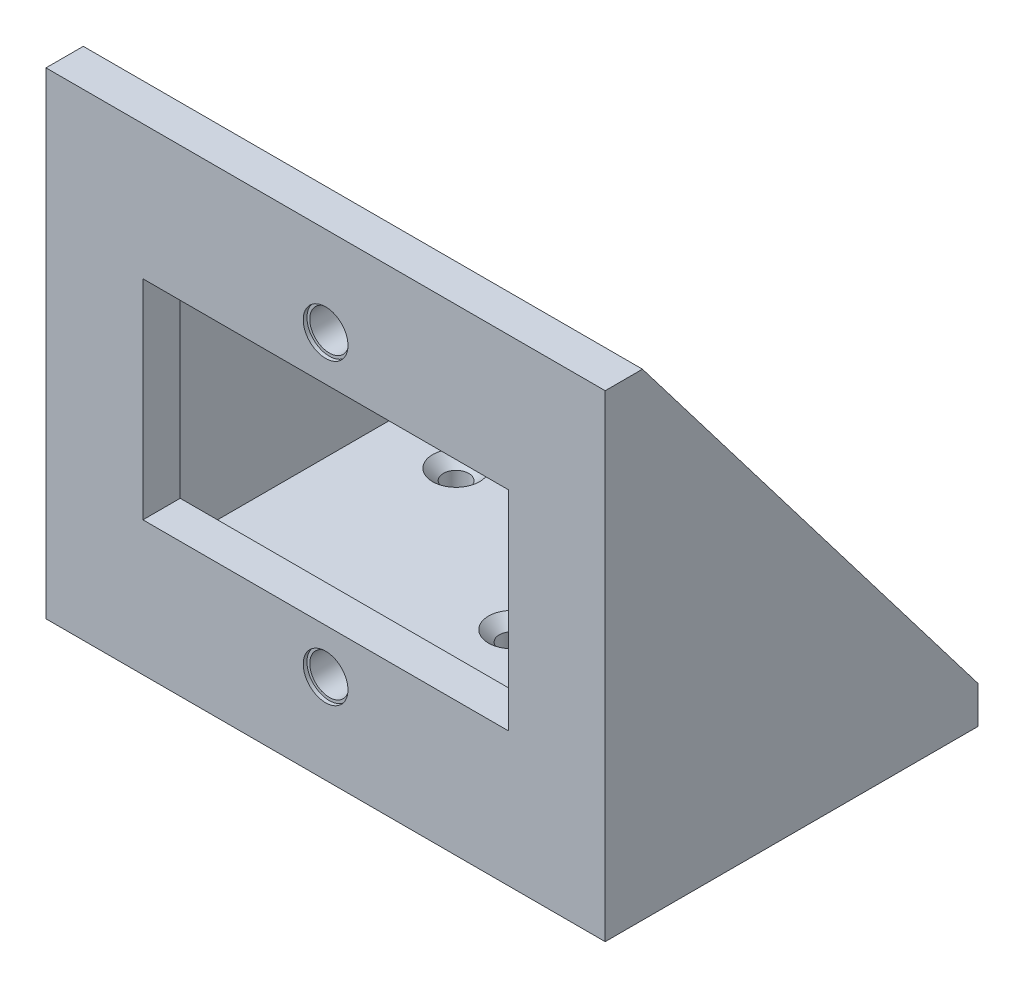
from build123d import *

# Parameters (mm, degrees)
SKETCH1_W                                       = 75
SKETCH1_H                                       = 50
BOSS_EXTRUDE1_DEPTH                             = 5
SKETCH2_W                                       = 75
SKETCH2_H                                       = 59
SKETCH2_W_2                                     = 49
SKETCH2_H_2                                     = 28
BOSS_EXTRUDE2_DEPTH                             = 5
BOSS_EXTRUDE3_DEPTH                             = 5
BOSS_EXTRUDE4_START                             = -75
BOSS_EXTRUDE4_DEPTH                             = 5
CBORE_FOR_M3_SHCS1_D                            = 5.25
CBORE_FOR_M3_SHCS1_DEPTH                        = 5
CBORE_FOR_M3_SHCS1_CBORE_D                      = 6
CBORE_FOR_M3_SHCS1_CBORE_DEPTH                  = 0.5
CBORE_FOR_M3_SHCS1_TIP                          = 1.577259125
CSK_FOR_M3_FLAT_HEAD_MACHINE_SCREW1_D           = 3.4
CSK_FOR_M3_FLAT_HEAD_MACHINE_SCREW1_CSINK_D     = 6.3
CSK_FOR_M3_FLAT_HEAD_MACHINE_SCREW1_CSINK_ANGLE = 90


with BuildPart() as part:
    # Sketch1 → Boss-Extrude1 (new body)
    with BuildSketch(Plane(origin=(0, 0, 0), x_dir=(1, 0, 0), z_dir=(0, 1, 0))):
        Rectangle(SKETCH1_W, SKETCH1_H)
    extrude(amount=BOSS_EXTRUDE1_DEPTH)

    # Sketch2 → Boss-Extrude2 (add)
    with BuildSketch(Plane.XY.offset(25)):
        with Locations((0, 34.5)):
            Rectangle(SKETCH2_W, SKETCH2_H)
        with Locations((0, 32)):
            Rectangle(SKETCH2_W_2, SKETCH2_H_2, mode=Mode.SUBTRACT)
    extrude(amount=-BOSS_EXTRUDE2_DEPTH)

    # Sketch3 → Boss-Extrude3 (add)
    with BuildSketch(Plane(origin=(37.5, 0, 0), x_dir=(0, 0, -1), z_dir=(1, 0, 0))):
        Polygon((-20, 64), (25, 5), (-20, 5), align=None)
    extrude(amount=-BOSS_EXTRUDE3_DEPTH)

    # Sketch3<2> → Boss-Extrude4 (add)
    with BuildSketch(Plane(origin=(37.5, 0, 0), x_dir=(0, 0, -1), z_dir=(1, 0, 0)).offset(BOSS_EXTRUDE4_START)):
        Polygon((-20, 64), (25, 5), (-20, 5), align=None)
    extrude(amount=BOSS_EXTRUDE4_DEPTH)

    # CBORE for M3 SHCS1
    with Locations(Plane.XY.offset(25)):
        with Locations((0, 52), (0, 12)):
            CounterBoreHole(CBORE_FOR_M3_SHCS1_D / 2, CBORE_FOR_M3_SHCS1_CBORE_D / 2, CBORE_FOR_M3_SHCS1_CBORE_DEPTH, depth=CBORE_FOR_M3_SHCS1_DEPTH)
            with Locations((0, 0, -(CBORE_FOR_M3_SHCS1_DEPTH + CBORE_FOR_M3_SHCS1_TIP / 2))):  # 118° drill point
                Cone(0, CBORE_FOR_M3_SHCS1_D / 2, CBORE_FOR_M3_SHCS1_TIP, mode=Mode.SUBTRACT)

    # CSK for M3 Flat Head Machine Screw1 (through all)
    with Locations(Plane(origin=(0, 5, 0), x_dir=(1, 0, 0), z_dir=(0, 1, 0))):
        with Locations((22.5, 15), (0, 0), (-22.5, 15), (-22.5, -15), (22.5, -15)):
            CounterSinkHole(CSK_FOR_M3_FLAT_HEAD_MACHINE_SCREW1_D / 2, CSK_FOR_M3_FLAT_HEAD_MACHINE_SCREW1_CSINK_D / 2, counter_sink_angle=CSK_FOR_M3_FLAT_HEAD_MACHINE_SCREW1_CSINK_ANGLE)


solid = part.part
